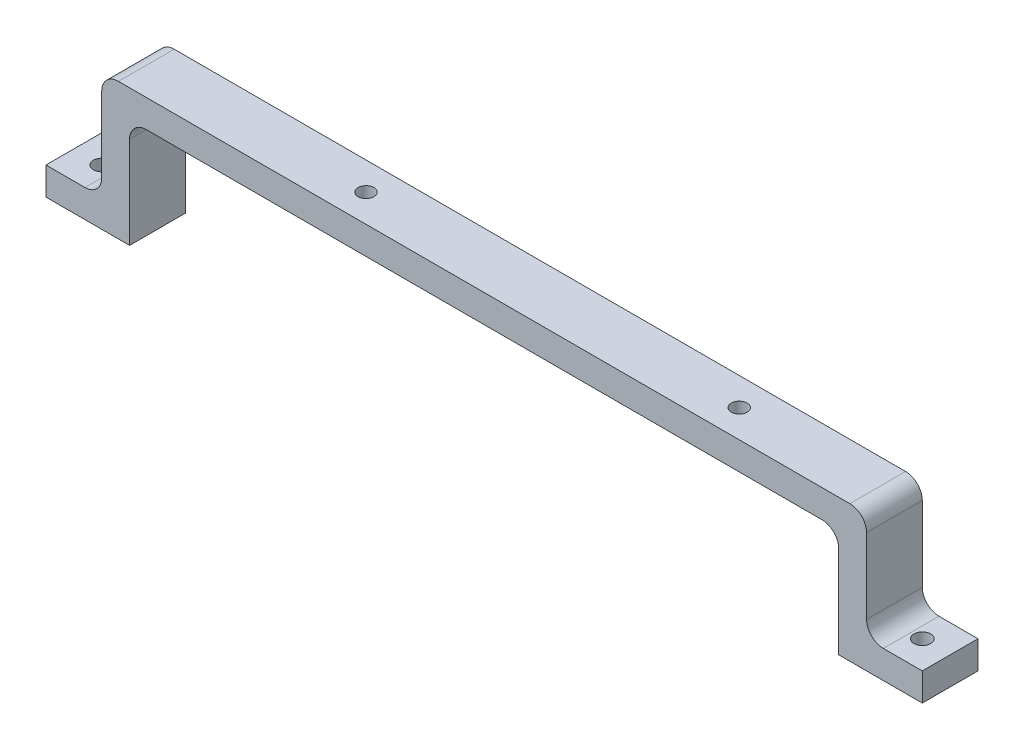
from build123d import *

# Parameters (mm, degrees)
BOSS_EXTRUDE1_DEPTH  = 10
SKETCH2_R            = 1.5
CUT_EXTRUDE1_DEPTH   = 10
FILLET1_R            = 3
FILLET1_OF_MIRROR1_R = 3
SKETCH3_R            = 1.425
CUT_EXTRUDE2_DEPTH   = 10


with BuildPart() as part:
    # Sketch1 → Boss-Extrude1 (new body)
    with BuildSketch(Plane.XY):
        Polygon((0, 0), (-68.64, 0), (-68.64, -19.5), (-78.64, -19.5), (-78.64, -24.5), (-63.64, -24.5), (-63.64, -5), (0, -5), align=None)
    boss_extrude1 = extrude(amount=BOSS_EXTRUDE1_DEPTH)

    # Sketch2 → Cut-Extrude1 (cut)
    with BuildSketch(Plane(origin=(0, -19.5, 0), x_dir=(1, 0, 0), z_dir=(0, 1, 0))):
        with Locations(Location((-73.64, -5, 0), (0, 0, 180))):
            Circle(SKETCH2_R)
    cut_extrude1 = extrude(amount=-CUT_EXTRUDE1_DEPTH, mode=Mode.SUBTRACT)

    # Fillet1
    fillet1_edges = [part.edges().sort_by_distance(p)[0] for p in [
        (-63.64, -5, 5),
        (-68.64, -19.5, 5),
        (-68.64, 0, 5),
    ]]
    fillet(fillet1_edges, radius=FILLET1_R)

    # Mirror1: Boss-Extrude1, Cut-Extrude1 across plane
    add(boss_extrude1.mirror(Plane(origin=(0, -5, 10), x_dir=(0, 0, 1), z_dir=(-1, 0, 0))))
    add(cut_extrude1.mirror(Plane(origin=(0, -5, 10), x_dir=(0, 0, 1), z_dir=(-1, 0, 0))), mode=Mode.SUBTRACT)

    # Fillet1 of Mirror1
    fillet1_of_mirror1_edges = [part.edges().sort_by_distance(p)[0] for p in [
        (63.64, -5, 5),
        (68.64, -19.5, 5),
        (68.64, 0, 5),
    ]]
    fillet(fillet1_of_mirror1_edges, radius=FILLET1_OF_MIRROR1_R)

    # Sketch3 → Cut-Extrude2 (cut)
    with BuildSketch(Plane(origin=(0, 0, 0), x_dir=(1, 0, 0), z_dir=(0, 1, 0))):
        with Locations(Location((40.788603054, -5, 0), (0, 0, 180))):
            Circle(SKETCH3_R)
        with Locations(Location((-26.211396946, -5, 0), (0, 0, 180))):
            Circle(SKETCH3_R)
    extrude(amount=-CUT_EXTRUDE2_DEPTH, mode=Mode.SUBTRACT)


solid = part.part
